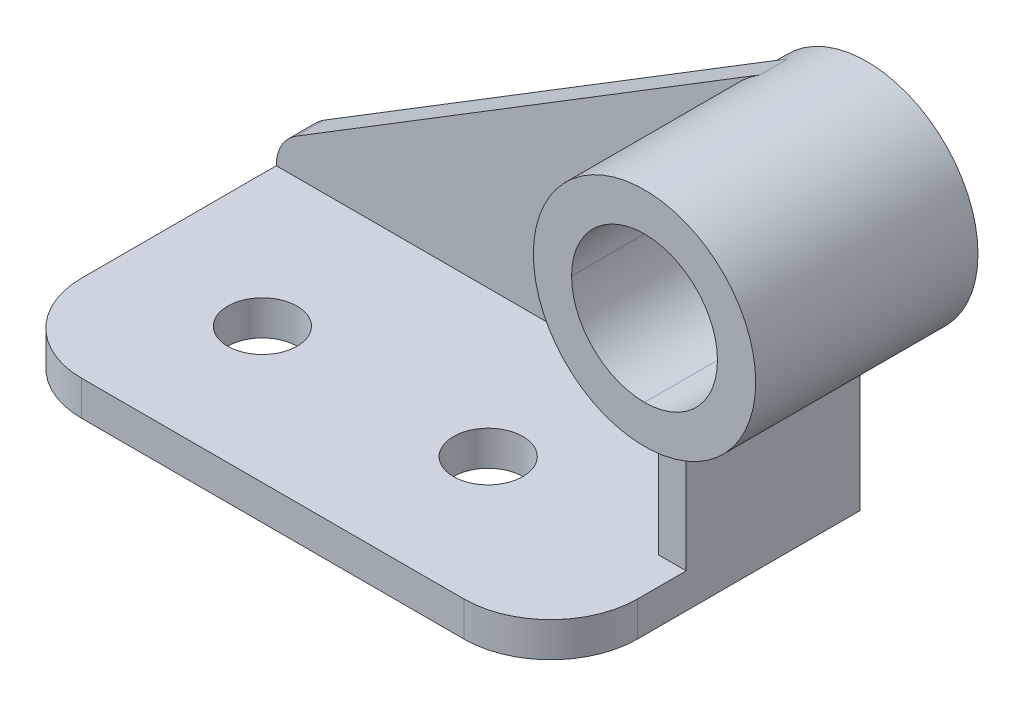
from build123d import *

# Parameters (mm, degrees)
BASE_EXTRUDE_DEPTH       = 10
BOSS_EXTRUDE1_DEPTH      = 8
SKETCH3_R                = 32
BOSS_EXTRUDE2_DEPTH      = 64
SKETCH7_R                = 21
CUT_EXTRUDE1_DEPTH       = 237.258333186
BOSS_EXTRUDE3_REACH      = 233.901
BOSS_EXTRUDE3_END_RADIUS = 32
SKETCH4_W                = 8
SKETCH4_H                = 42
HOLE1_D                  = 20
LPATTERN1_COUNT          = 2
LPATTERN1_PITCH          = 65


with BuildPart() as part:
    # Sketch1 → Base-Extrude (new body)
    with BuildSketch(Plane(origin=(0, 0, 0), x_dir=(1, 0, 0), z_dir=(0, 1, 0))):
        with BuildLine():
            Line((25, 0), (135, 0))
            ThreePointArc((135, 0), (152.67766953, 7.32233047), (160, 25))
            Line((160, 25), (160, 89))
            Line((160, 89), (0, 89))
            Line((0, 89), (0, 25))
            ThreePointArc((0, 25), (7.32233047, 7.32233047), (25, 0))
        make_face()
    extrude(amount=BASE_EXTRUDE_DEPTH)

    # Sketch2 → Boss-Extrude1 (add)
    with BuildSketch(Plane(origin=(0, 0, -89), x_dir=(-1, 0, 0), z_dir=(0, 0, -1))):
        with BuildLine():
            Line((-160, 10), (0, 10))
            ThreePointArc((0, 10), (-1.526648698, 15.857381028), (-5.718152085, 20.224401536))
            Line((-5.718152085, 20.224401536), (-139.248405559, 102.265070762))
            ThreePointArc((-139.248405559, 102.265070762), (-186.188017348, 85.615253581), (-160, 43.250984267))
            Line((-160, 43.250984267), (-160, 10))
        make_face()
    extrude(amount=-BOSS_EXTRUDE1_DEPTH)

    # Sketch3 → Boss-Extrude2 (add)
    with BuildSketch(Plane(origin=(0, 0, -95), x_dir=(-1, 0, 0), z_dir=(0, 0, -1))):
        with Locations((-156, 75)):
            Circle(SKETCH3_R)
    extrude(amount=-BOSS_EXTRUDE2_DEPTH)

    # Sketch7 → Cut-Extrude1 (cut, through all)
    with BuildSketch(Plane(origin=(0, 0, -95), x_dir=(-1, 0, 0), z_dir=(0, 0, -1))):
        with Locations((-156, 75)):
            Circle(SKETCH7_R)
    extrude(amount=-CUT_EXTRUDE1_DEPTH, mode=Mode.SUBTRACT)

    # Boss-Extrude3: up to this cylinder (the profile starts outside it)
    boss_extrude3_end = Plane(origin=(156, 75, -60), z_dir=(0, 0, -1)) * Cylinder(BOSS_EXTRUDE3_END_RADIUS, 532.802, mode=Mode.PRIVATE)
    # Sketch4 → Boss-Extrude3 (add, up to the surface)
    with BuildSketch(Plane(origin=(0, 10, 0), x_dir=(-1, 0, 0), z_dir=(0, 1, 0)), mode=Mode.PRIVATE) as boss_extrude3_sk1:
        with Locations((-156, -60)):
            Rectangle(SKETCH4_W, SKETCH4_H)
    boss_extrude3_tool1 = extrude(boss_extrude3_sk1.sketch, amount=BOSS_EXTRUDE3_REACH, mode=Mode.PRIVATE) - boss_extrude3_end
    add(boss_extrude3_tool1.solids().sort_by_distance((156, 10, -60))[0])

    # Hole1 (through all)
    with Locations(Plane(origin=(0, 10, 0), x_dir=(-1, 0, 0), z_dir=(0, 1, 0))):
        with Locations((-38, -39)):
            hole1 = Hole(HOLE1_D / 2)

    # LPattern1: Hole1 ×2
    with Locations(*[(i * LPATTERN1_PITCH, 0, 0) for i in range(1, LPATTERN1_COUNT)]):
        add(hole1, mode=Mode.SUBTRACT)


solid = part.part
